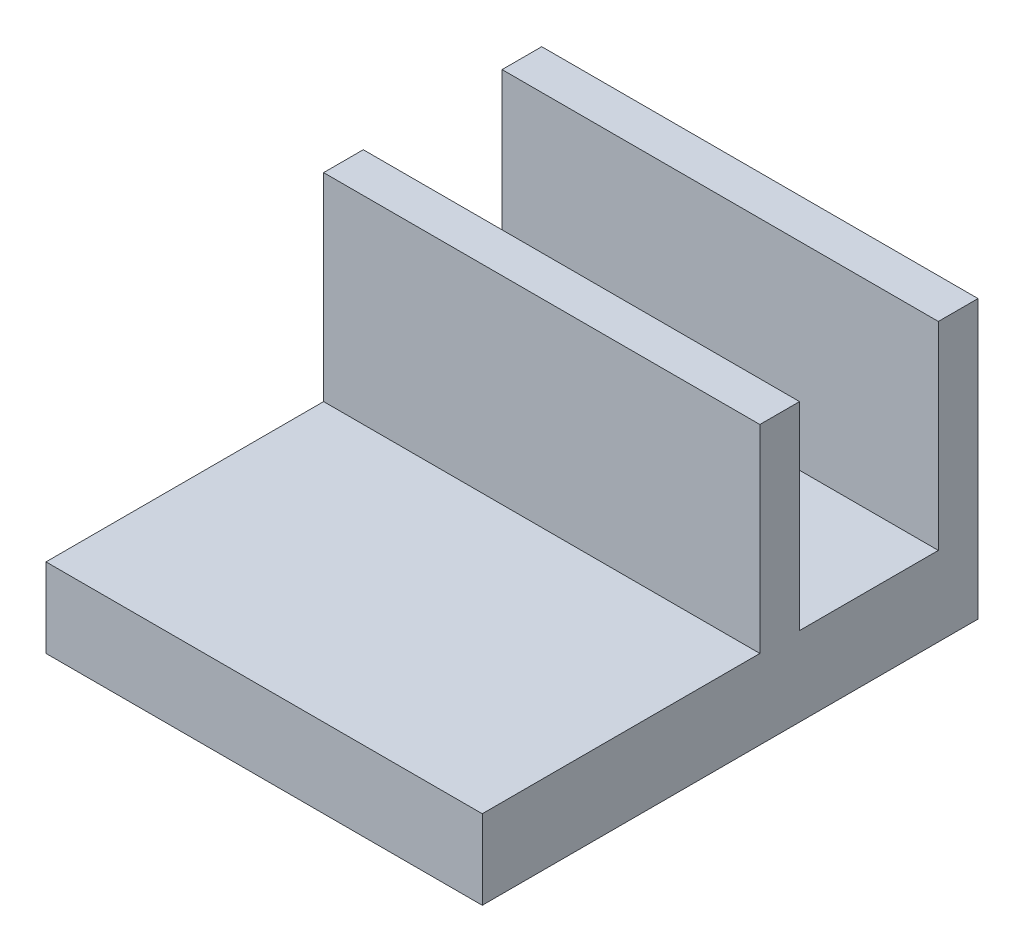
from build123d import *

# Parameters (mm, degrees)
SKETCH_2_W      = 22
SKETCH_2_H      = 25
EXTRUDE_1_DEPTH = 4
SKETCH_3_W      = 22
SKETCH_3_H      = 2
EXTRUDE_2_DEPTH = 10


with BuildPart() as part:
    # Эскиз2 → Бобышка-Вытянуть1 (new body)
    with BuildSketch(Plane(origin=(0, 0, 0), x_dir=(1, 0, 0), z_dir=(0, 1, 0))):
        with Locations((-34.831985697, -17.94161698)):
            Rectangle(SKETCH_2_W, SKETCH_2_H)
    extrude(amount=EXTRUDE_1_DEPTH)

    # Эскиз3 → Бобышка-Вытянуть2 (add)
    with BuildSketch(Plane(origin=(0, 4, 0), x_dir=(1, 0, 0), z_dir=(0, 1, 0))):
        with Locations((-34.831985697, -6.44161698)):
            Rectangle(SKETCH_3_W, SKETCH_3_H)
        with Locations((-34.831985697, -15.44161698)):
            Rectangle(SKETCH_3_W, SKETCH_3_H)
    extrude(amount=EXTRUDE_2_DEPTH)


solid = part.part
